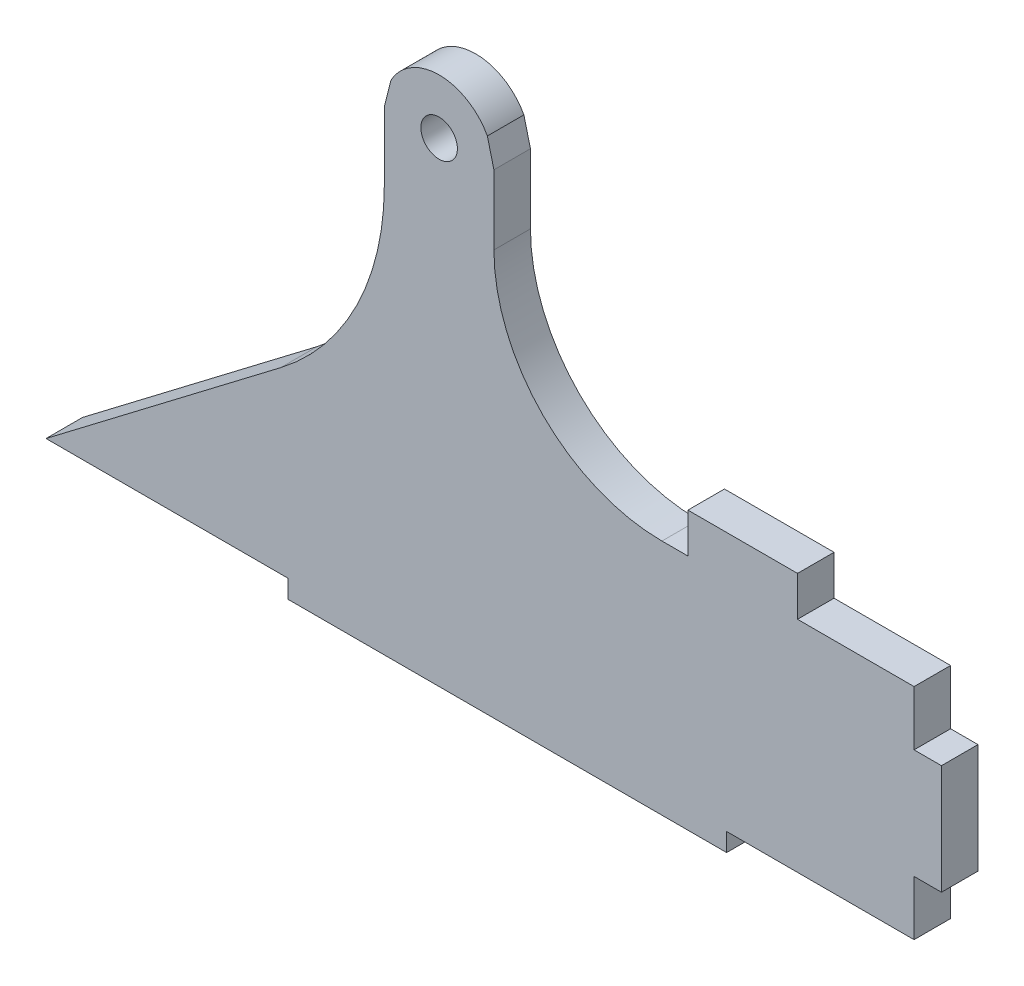
from build123d import *

# Parameters (mm, degrees)
SKETCH1_R           = 6.35
SKETCH1_W           = 38.1
SKETCH1_H           = 13.818872092
BOSS_EXTRUDE1_DEPTH = 12.7


with BuildPart() as part:
    # Sketch1 → Boss-Extrude1 (new body)
    # profile 1 of 2: a face of its own
    with BuildSketch(Plane.XY):
        with BuildLine():
            Line((129.803523023, 13.72866743), (129.803523023, 32.77866743))
            Line((129.803523023, 32.77866743), (104.403523023, 32.77866743))
            Line((104.403523023, 32.77866743), (89.290523023, 32.77866743))
            Line((89.290523023, 32.77866743), (51.190523023, 32.77866743))
            Line((51.190523023, 32.77866743), (44.078523023, 32.77866743))
            Line((44.078523023, 32.77866743), (42.173523023, 32.77866743))
            ThreePointArc((42.173523023, 32.77866743), (0.864344867, 49.889489273), (-16.246476977, 91.19866743))
            Line((-16.246476977, 91.19866743), (-16.246476977, 115.32866743))
            Line((-16.246476977, 115.32866743), (-18.528129693, 124.368857105))
            ThreePointArc((-18.528129693, 124.368857105), (-35.296476977, 134.37866743), (-52.064824261, 124.368857105))
            Line((-52.064824261, 124.368857105), (-54.346476977, 115.32866743))
            Line((-54.346476977, 115.32866743), (-54.346476977, 91.438289009))
            ThreePointArc((-54.346476977, 91.438289009), (-63.850433524, 50.845698757), (-90.386686587, 18.691214671))
            Line((-90.386686587, 18.691214671), (-171.948476977, -43.42133257))
            Line((-171.948476977, -43.42133257), (-87.747476977, -43.42133257))
            Line((-87.747476977, -43.42133257), (-87.747476977, -49.77133257))
            Line((-87.747476977, -49.77133257), (-61.229320991, -49.77133257))
            Line((-61.229320991, -49.77133257), (-16.694588765, -49.77133257))
            Line((-16.694588765, -49.77133257), (64.652523023, -49.77133257))
            Line((64.652523023, -49.77133257), (64.652523023, -43.42133257))
            Line((64.652523023, -43.42133257), (129.803523023, -43.42133257))
            Line((129.803523023, -43.42133257), (129.803523023, -24.37133257))
            Line((129.803523023, -24.37133257), (139.328523023, -24.37133257))
            Line((139.328523023, -24.37133257), (139.328523023, 13.72866743))
            Line((139.328523023, 13.72866743), (129.803523023, 13.72866743))
        make_face()
        with Locations((-35.296476977, 115.32866743)):
            Circle(SKETCH1_R, mode=Mode.SUBTRACT)
    # profile 2 of 2: a face of its own
    with BuildSketch(Plane.XY):
        with Locations((70.240523023, 39.688103476)):
            Rectangle(SKETCH1_W, SKETCH1_H)
    extrude(amount=BOSS_EXTRUDE1_DEPTH)


solid = part.part
